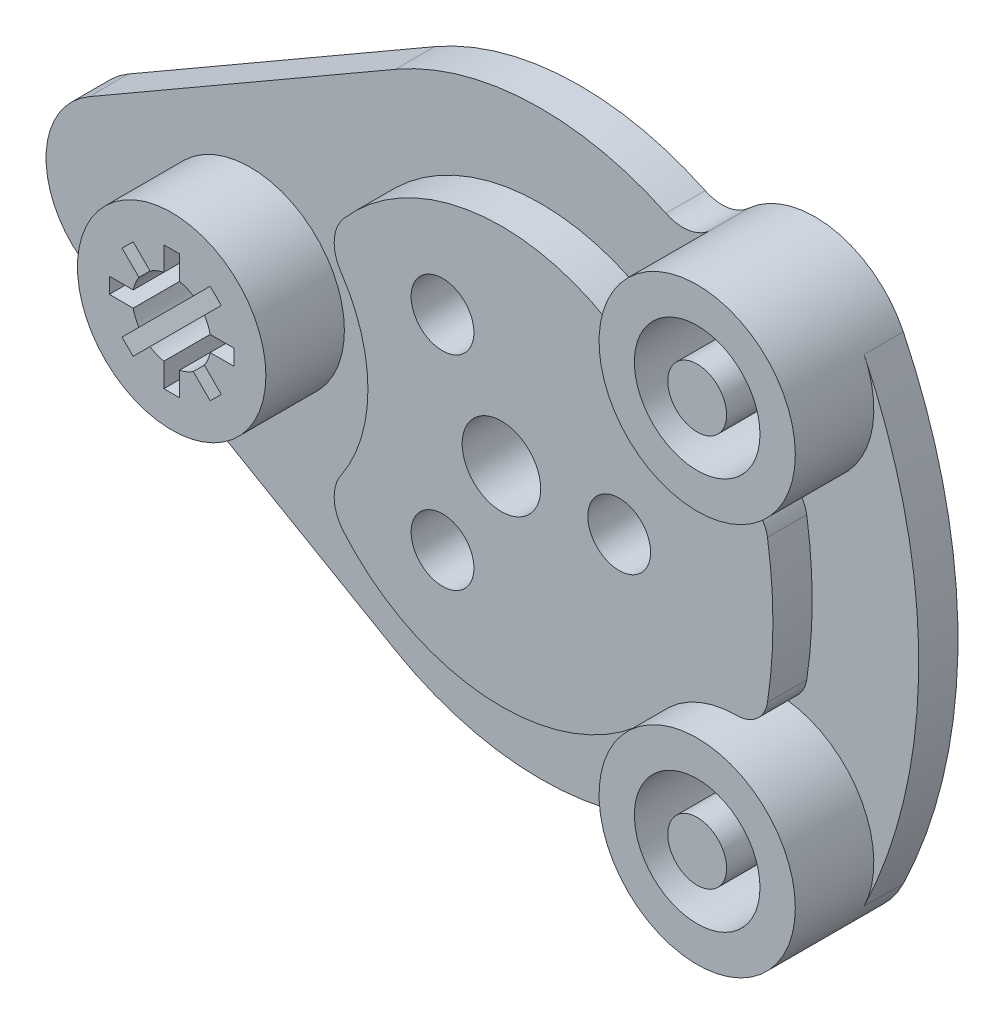
from build123d import *

# Parameters (mm, degrees)
SKETCH_1_R        = 24
EXTRUDE_1_DEPTH   = 10
EXTRUDE_1_2_DEPTH = 10
SKETCH_1_R_2      = 16
SKETCH_1_R_3      = 7.5
EXTRUDE_1_3_DEPTH = 10
EXTRUDE_1_4_DEPTH = 10
SKETCH_1_3_R      = 8
SKETCH_1_3_R_2    = 10
EXTRUDE_2_DEPTH   = 20
SKETCH_1_4_R      = 24
SKETCH_1_4_R_2    = 25
SKETCH_1_4_R_3    = 16
SKETCH_1_4_R_4    = 7.5
EXTRUDE_3_DEPTH   = 30


with BuildPart() as part:
    # Эскиз1 → Бобышка-Вытянуть1 (new body)
    with BuildSketch(Plane.XY):
        with BuildLine():
            Line((-37, 64.08587988), (-115, 19.052558883))
            ThreePointArc((-115, 19.052558883), (-126, 0), (-115, -19.052558883))
            Line((-115, -19.052558883), (-37, -64.08587988))
            ThreePointArc((-37, -64.08587988), (-2.882289769, -73.9438463), (31.899251195, -66.771534153))
            ThreePointArc((31.899251195, -66.771534153), (37.687076323, -65.904409607), (42.968977208, -68.424796032))
            ThreePointArc((42.968977208, -68.424796032), (34.921589274, -51.658469616), (40.67853159, -33.974358974))
            ThreePointArc((40.67853159, -33.974358974), (0.383160449, -52.998614964), (-40.183060968, -34.55895848))
            ThreePointArc((-40.183060968, -34.55895848), (-42.584830472, -28.612982427), (-40.881081081, -22.430720221))
            ThreePointArc((-40.881081081, -22.430720221), (-34, 0), (-40.881081081, 22.430720221))
            ThreePointArc((-40.881081081, 22.430720221), (-42.584830472, 28.612982427), (-40.183060968, 34.55895848))
            ThreePointArc((-40.183060968, 34.55895848), (0.383160449, 52.998614964), (40.67853159, 33.974358974))
            ThreePointArc((40.67853159, 33.974358974), (34.921589274, 51.658469616), (42.968977208, 68.424796032))
            ThreePointArc((42.968977208, 68.424796032), (37.687076323, 65.904409607), (31.899251195, 66.771534153))
            ThreePointArc((31.899251195, 66.771534153), (-2.882289769, 73.9438463), (-37, 64.08587988))
        make_face()
        with Locations((-74, 0)):
            Circle(SKETCH_1_R, mode=Mode.SUBTRACT)
    extrude(amount=EXTRUDE_1_DEPTH)



with BuildPart() as body_2:
    # Эскиз1 → Extrude 1 2 (new body)
    with BuildSketch(Plane.XY):
        with BuildLine():
            ThreePointArc((82.379904251, -60.869565217), (96.304942302, 0), (82.379904251, 60.869565217))
            ThreePointArc((82.379904251, 60.869565217), (81.041257035, 36.709761673), (59.866518188, 25))
            ThreePointArc((59.866518188, 25), (65.076398911, 23.071008389), (67.773825581, 18.214285714))
            ThreePointArc((67.773825581, 18.214285714), (69.164214689, 0), (67.773825581, -18.214285714))
            ThreePointArc((67.773825581, -18.214285714), (65.076398911, -23.071008389), (59.866518188, -25))
            ThreePointArc((59.866518188, -25), (81.041257035, -36.709761673), (82.379904251, -60.869565217))
        make_face()
    extrude(amount=EXTRUDE_1_2_DEPTH)


with BuildPart() as body_3:
    # Эскиз1 → Extrude 1 3 (new body)
    with BuildSketch(Plane.XY):
        with Locations((59.866518188, 50)):
            Circle(SKETCH_1_R_2)
        with Locations((59.866518188, 50)):
            Circle(SKETCH_1_R_3, mode=Mode.SUBTRACT)
    extrude(amount=EXTRUDE_1_3_DEPTH)


with BuildPart() as body_4:
    # Эскиз1 → Extrude 1 4 (new body)
    with BuildSketch(Plane.XY):
        with Locations((59.866518188, -50)):
            Circle(SKETCH_1_R_2)
        with Locations((59.866518188, -50)):
            Circle(SKETCH_1_R_3, mode=Mode.SUBTRACT)
    extrude(amount=EXTRUDE_1_4_DEPTH)


with BuildPart() as part_1:
    add(part.part)

    add(body_2.part)  # Бобышка-Вытянуть2 merges body 2
    # Эскиз1<3> → Бобышка-Вытянуть2 (add)
    with BuildSketch(Plane.XY):
        with BuildLine():
            ThreePointArc((59.866518188, 25), (49.275036367, 27.354459317), (40.67853159, 33.974358974))
            ThreePointArc((40.67853159, 33.974358974), (0.383160449, 52.998614964), (-40.183060968, 34.55895848))
            ThreePointArc((-40.183060968, 34.55895848), (-42.584830472, 28.612982427), (-40.881081081, 22.430720221))
            ThreePointArc((-40.881081081, 22.430720221), (-34, 0), (-40.881081081, -22.430720221))
            ThreePointArc((-40.881081081, -22.430720221), (-42.584830472, -28.612982427), (-40.183060968, -34.55895848))
            ThreePointArc((-40.183060968, -34.55895848), (0.383160449, -52.998614964), (40.67853159, -33.974358974))
            ThreePointArc((40.67853159, -33.974358974), (49.275036367, -27.354459317), (59.866518188, -25))
            ThreePointArc((59.866518188, -25), (65.076398911, -23.071008389), (67.773825581, -18.214285714))
            ThreePointArc((67.773825581, -18.214285714), (69.164214689, 0), (67.773825581, 18.214285714))
            ThreePointArc((67.773825581, 18.214285714), (65.076398911, 23.071008389), (59.866518188, 25))
        make_face()
        with Locations((-15, -25.980762114)):
            Circle(SKETCH_1_3_R, mode=Mode.SUBTRACT)
        with Locations((-15, 25.980762114)):
            Circle(SKETCH_1_3_R, mode=Mode.SUBTRACT)
        Circle(SKETCH_1_3_R_2, mode=Mode.SUBTRACT)
        with Locations((30, 0)):
            Circle(SKETCH_1_3_R, mode=Mode.SUBTRACT)
    extrude(amount=EXTRUDE_2_DEPTH)

    # Эскиз1<4> → Бобышка-Вытянуть3 (add)
    # profile 1 of 5: a face of its own
    with BuildSketch(Plane.XY):
        with Locations((-74, 0)):
            Circle(SKETCH_1_4_R)
        with BuildLine():
            Line((-82.342416793, 5.513989668), (-86.639185723, 9.810758598))
            Line((-86.639185723, 9.810758598), (-83.810758598, 12.639185723))
            Line((-83.810758598, 12.639185723), (-79.513989668, 8.342416793))
            ThreePointArc((-79.513989668, 8.342416793), (-77.826834324, 9.238795325), (-76, 9.797958971))
            Line((-76, 9.797958971), (-76, 15.874507866))
            Line((-76, 15.874507866), (-72, 15.874507866))
            Line((-72, 15.874507866), (-72, 9.797958971))
            ThreePointArc((-72, 9.797958971), (-70.173165676, 9.238795325), (-68.486010332, 8.342416793))
            Line((-68.486010332, 8.342416793), (-64.189241402, 12.639185723))
            Line((-64.189241402, 12.639185723), (-61.360814277, 9.810758598))
            Line((-61.360814277, 9.810758598), (-65.657583207, 5.513989668))
            ThreePointArc((-65.657583207, 5.513989668), (-64.761204675, 3.826834324), (-64.202041029, 2))
            Line((-64.202041029, 2), (-58.125492134, 2))
            Line((-58.125492134, 2), (-58.125492134, -2))
            Line((-58.125492134, -2), (-64.202041029, -2))
            ThreePointArc((-64.202041029, -2), (-64.761204675, -3.826834324), (-65.657583207, -5.513989668))
            Line((-65.657583207, -5.513989668), (-61.360814277, -9.810758598))
            Line((-61.360814277, -9.810758598), (-64.189241402, -12.639185723))
            Line((-64.189241402, -12.639185723), (-68.486010332, -8.342416793))
            ThreePointArc((-68.486010332, -8.342416793), (-70.173165676, -9.238795325), (-72, -9.797958971))
            Line((-72, -9.797958971), (-72, -15.874507866))
            Line((-72, -15.874507866), (-76, -15.874507866))
            Line((-76, -15.874507866), (-76, -9.797958971))
            ThreePointArc((-76, -9.797958971), (-77.826834324, -9.238795325), (-79.513989668, -8.342416793))
            Line((-79.513989668, -8.342416793), (-83.810758598, -12.639185723))
            Line((-83.810758598, -12.639185723), (-86.639185723, -9.810758598))
            Line((-86.639185723, -9.810758598), (-82.342416793, -5.513989668))
            ThreePointArc((-82.342416793, -5.513989668), (-83.238795325, -3.826834324), (-83.797958971, -2))
            Line((-83.797958971, -2), (-89.874507866, -2))
            Line((-89.874507866, -2), (-89.874507866, 2))
            Line((-89.874507866, 2), (-83.797958971, 2))
            ThreePointArc((-83.797958971, 2), (-83.238795325, 3.826834324), (-82.342416793, 5.513989668))
        make_face(mode=Mode.SUBTRACT)
    # profile 2 of 5: a face of its own
    with BuildSketch(Plane.XY):
        with Locations(Location((59.866518188, -50, 0), (0, 0, 140.13165845))):
            Circle(SKETCH_1_4_R_2)
        with Locations((59.866518188, -50)):
            Circle(SKETCH_1_4_R_3, mode=Mode.SUBTRACT)
    # profile 3 of 5: a face of its own
    with BuildSketch(Plane.XY):
        with Locations(Location((59.866518188, 50, 0), (0, 0, 219.86834155))):
            Circle(SKETCH_1_4_R_2)
        with Locations((59.866518188, 50)):
            Circle(SKETCH_1_4_R_3, mode=Mode.SUBTRACT)
    # profile 4 of 5: a face of its own
    with BuildSketch(Plane.XY):
        with Locations((59.866518188, 50)):
            Circle(SKETCH_1_4_R_4)
    # profile 5 of 5: a face of its own
    with BuildSketch(Plane.XY):
        with Locations((59.866518188, -50)):
            Circle(SKETCH_1_4_R_4)
    extrude(amount=EXTRUDE_3_DEPTH)


with BuildPart() as extrude_3_piece_1:
    # of the separate pieces the step leaves, piece 1, a body of its own (extrude_3_pieces)
    add(part_1.part.solids().sort_by_distance((-37, 64.08587988, 0))[0])


with BuildPart() as extrude_3_piece_2:
    # of the separate pieces the step leaves, piece 2, a body of its own (extrude_3_pieces)
    add(part_1.part.solids().sort_by_distance((67.366518188, 50, 0))[0])


with BuildPart() as extrude_3_piece_3:
    # of the separate pieces the step leaves, piece 3, a body of its own (extrude_3_pieces)
    add(part_1.part.solids().sort_by_distance((67.366518188, -50, 0))[0])


solid = Compound([body_3.part, body_4.part, extrude_3_piece_1.part, extrude_3_piece_2.part, extrude_3_piece_3.part])
